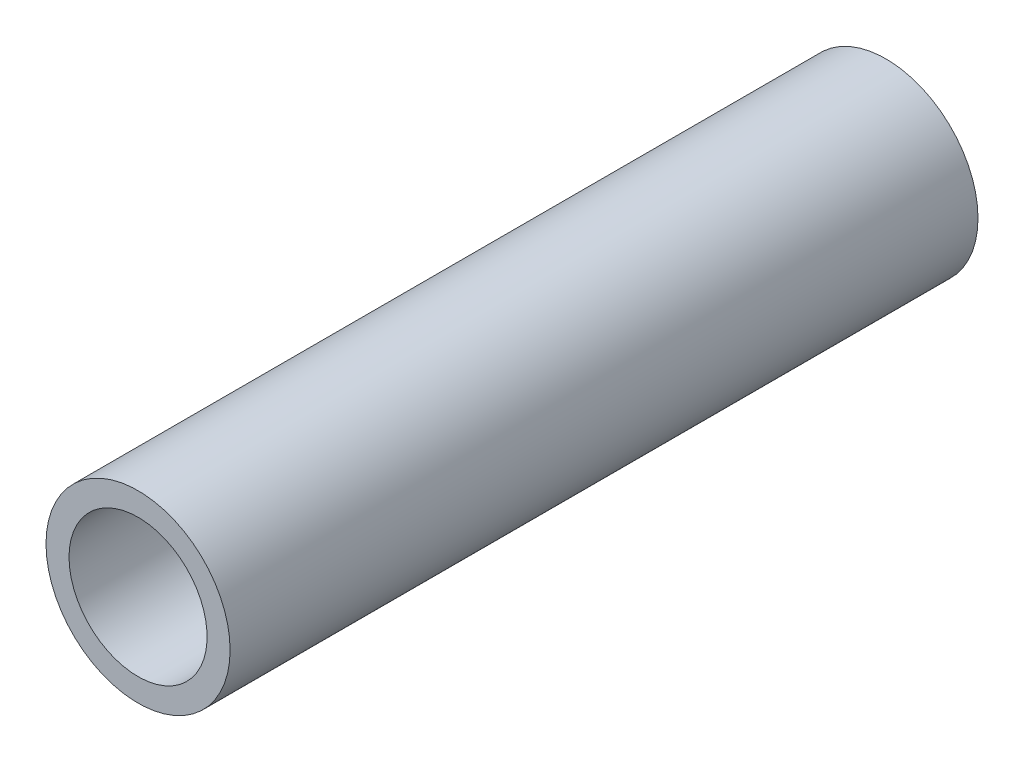
from build123d import *

# Parameters (mm, degrees)
TUBE_PROFILE_R   = 4
TUBE_PROFILE_R_2 = 3


with BuildPart() as part:
    # Tube: sweep along a curve in space
    with BuildLine() as tube_path:
        Line((180, 21, 32), (180, 21, -0.5))
    # Tube profile (on start of the path) → Tube (sweep)
    with BuildSketch(Plane(origin=(180, 21, 32), x_dir=(-1, 0, 0), z_dir=(0, 0, -1))):
        Circle(TUBE_PROFILE_R)
        Circle(TUBE_PROFILE_R_2, mode=Mode.SUBTRACT)
    sweep(path=tube_path.line)


solid = part.part
